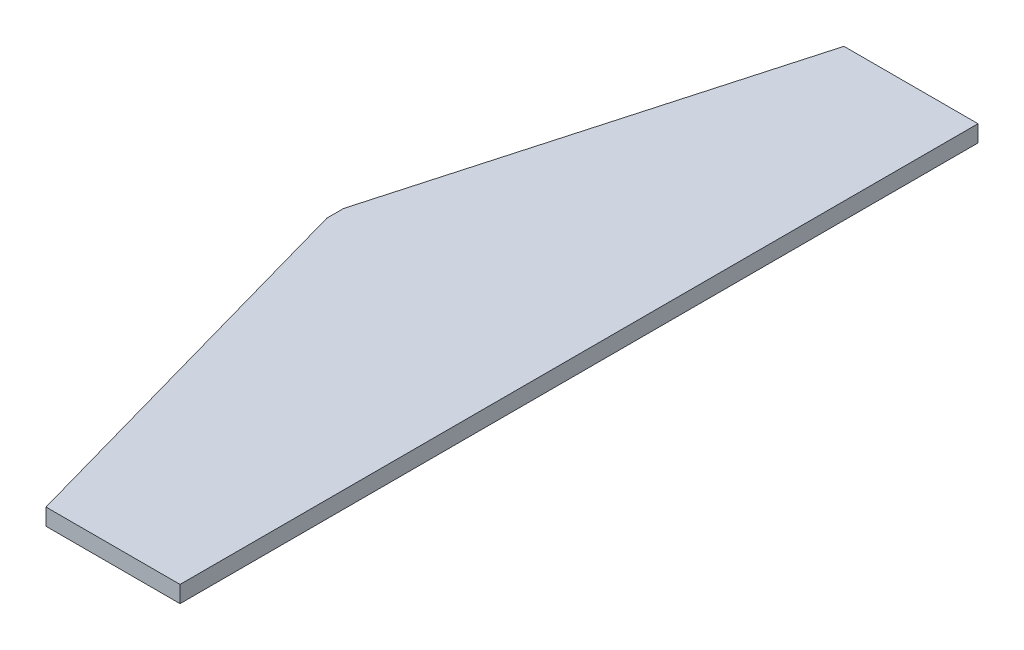
from build123d import *

# Parameters (mm, degrees)
BOSS_EXTRUDE1_DEPTH = 15
SCALE2_SCALE        = 0.6


with BuildPart() as part:
    # Sketch1 → Boss-Extrude1 (new body)
    with BuildSketch(Plane(origin=(0, 0, 0), x_dir=(1, 0, 0), z_dir=(0, 1, 0))):
        Polygon((219, 0), (219, 350.9), (98.6, 350.9), (0, 0), (0, -15), (98.6, -365.9), (219, -365.9), (219, -15), align=None)
    extrude(amount=BOSS_EXTRUDE1_DEPTH)


with BuildPart() as part_1:
    # Scale2: scaled about (131.165360429, 7.5, 7.5)
    add(part.part.scale(SCALE2_SCALE).moved(Location((52.466144172, 3, 3))))


solid = part_1.part
